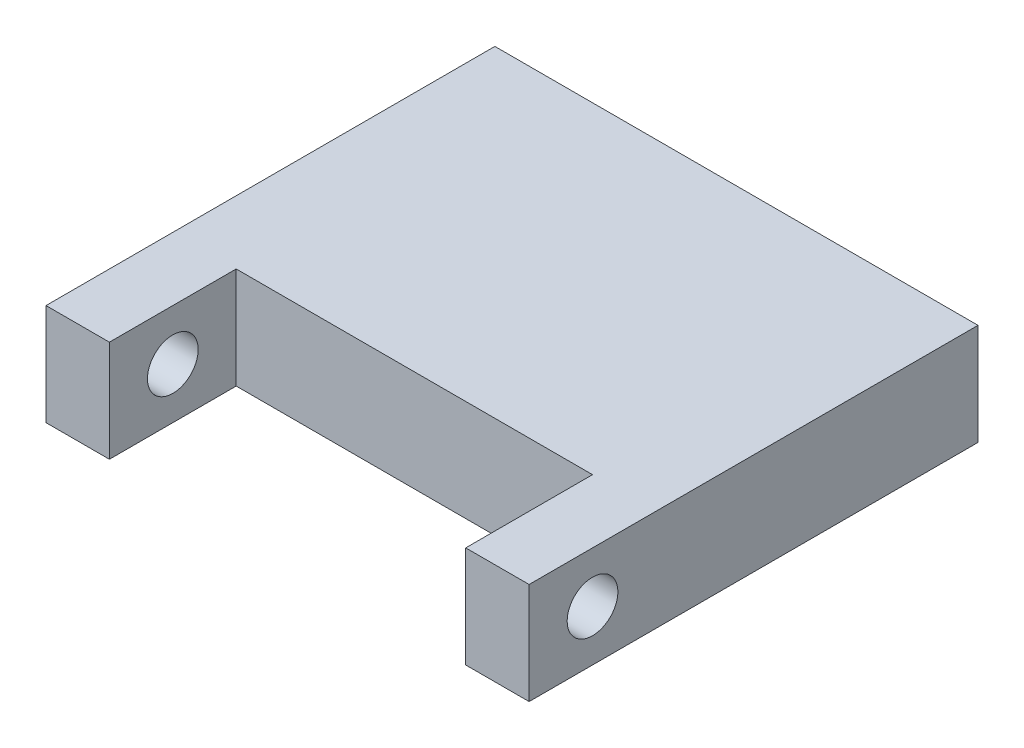
from build123d import *

# Parameters (mm, degrees)
SKETCH1_W           = 38.1
SKETCH1_H           = 25.4
BOSS_EXTRUDE1_DEPTH = 8
SKETCH2_W           = 5
SKETCH2_H           = 8
BOSS_EXTRUDE2_DEPTH = 10
SKETCH3_R           = 2
CUT_EXTRUDE1_DEPTH  = 30
LPATTERN1_COUNT     = 2
LPATTERN1_PITCH     = 33.1


with BuildPart() as part:
    # Sketch1 → Boss-Extrude1 (new body)
    with BuildSketch(Plane(origin=(0, 0, 0), x_dir=(1, 0, 0), z_dir=(0, 1, 0))):
        with Locations((19.05, 12.7)):
            Rectangle(SKETCH1_W, SKETCH1_H)
    extrude(amount=BOSS_EXTRUDE1_DEPTH)

    # Sketch2 → Boss-Extrude2 (add)
    with BuildSketch(Plane.XY):
        with Locations((35.6, 4)):
            Rectangle(SKETCH2_W, SKETCH2_H)
    boss_extrude2 = extrude(amount=BOSS_EXTRUDE2_DEPTH)

    # Sketch3 → Cut-Extrude1 (cut)
    with BuildSketch(Plane.ZY.offset(-33.1)):
        with Locations((5, 4)):
            Circle(SKETCH3_R)
    cut_extrude1 = extrude(amount=-CUT_EXTRUDE1_DEPTH, mode=Mode.SUBTRACT)

    # LPattern1: Boss-Extrude2, Cut-Extrude1 ×2
    with Locations(*[(-i * LPATTERN1_PITCH, 0, 0) for i in range(1, LPATTERN1_COUNT)]):
        add(boss_extrude2)
        add(cut_extrude1, mode=Mode.SUBTRACT)


solid = part.part
